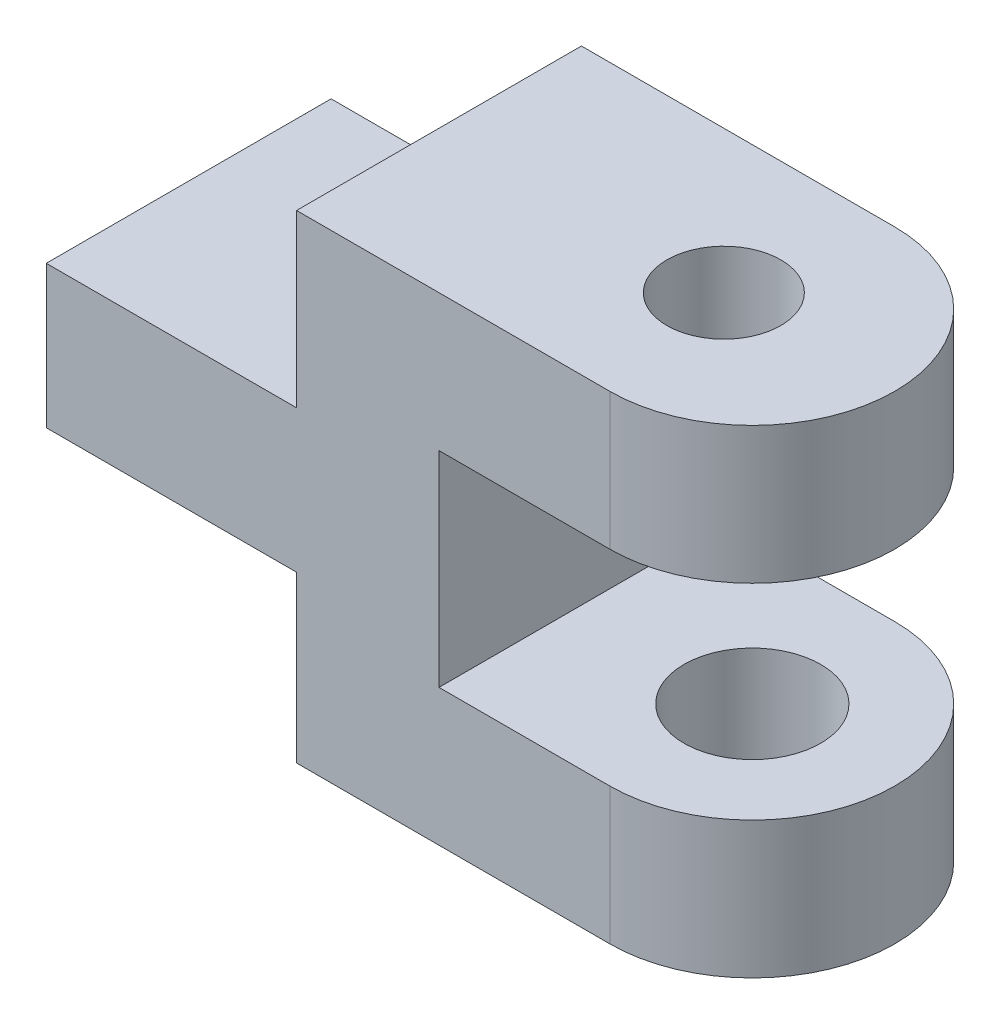
from build123d import *

# Parameters (mm, degrees)
BOSS_EXTRUDE1_DEPTH = 25
SKETCH2_R           = 12.5
BOSS_EXTRUDE2_DEPTH = 12
SKETCH3_R           = 12.5
BOSS_EXTRUDE3_DEPTH = 12
SKETCH4_R           = 5
CUT_EXTRUDE1_DEPTH  = 12
SKETCH5_R           = 6
CUT_EXTRUDE2_DEPTH  = 12


with BuildPart() as part:
    # Sketch1 → Boss-Extrude1 (new body)
    with BuildSketch(Plane.XY):
        Polygon((0, 0), (21.96969697, 0), (21.96969697, -14.5), (49.46969697, -14.5), (49.46969697, -2.5), (34.46969697, -2.5), (34.46969697, 15.5), (49.46969697, 15.5), (49.46969697, 27.5), (21.96969697, 27.5), (21.96969697, 12.5), (0, 12.5), align=None)
    extrude(amount=BOSS_EXTRUDE1_DEPTH)

    # Sketch2 → Boss-Extrude2 (add)
    with BuildSketch(Plane(origin=(0, 27.5, 0), x_dir=(1, 0, 0), z_dir=(0, 1, 0))):
        with Locations((49.46969697, -12.5)):
            Circle(SKETCH2_R)
    extrude(amount=-BOSS_EXTRUDE2_DEPTH)

    # Sketch3 → Boss-Extrude3 (add)
    with BuildSketch(Plane(origin=(0, -2.5, 0), x_dir=(1, 0, 0), z_dir=(0, 1, 0))):
        with Locations((49.46969697, -12.5)):
            Circle(SKETCH3_R)
    extrude(amount=-BOSS_EXTRUDE3_DEPTH)

    # Sketch4 → Cut-Extrude1 (cut)
    with BuildSketch(Plane(origin=(0, 27.5, 0), x_dir=(1, 0, 0), z_dir=(0, 1, 0))):
        with Locations(Location((46.96969697, -12.5, 0), (0, 0, 180))):
            Circle(SKETCH4_R)
    extrude(amount=-CUT_EXTRUDE1_DEPTH, mode=Mode.SUBTRACT)

    # Sketch5 → Cut-Extrude2 (cut)
    with BuildSketch(Plane(origin=(0, -2.5, 0), x_dir=(1, 0, 0), z_dir=(0, 1, 0))):
        with Locations(Location((49.46969697, -12.5, 0), (0, 0, 180))):
            Circle(SKETCH5_R)
    extrude(amount=-CUT_EXTRUDE2_DEPTH, mode=Mode.SUBTRACT)


solid = part.part
